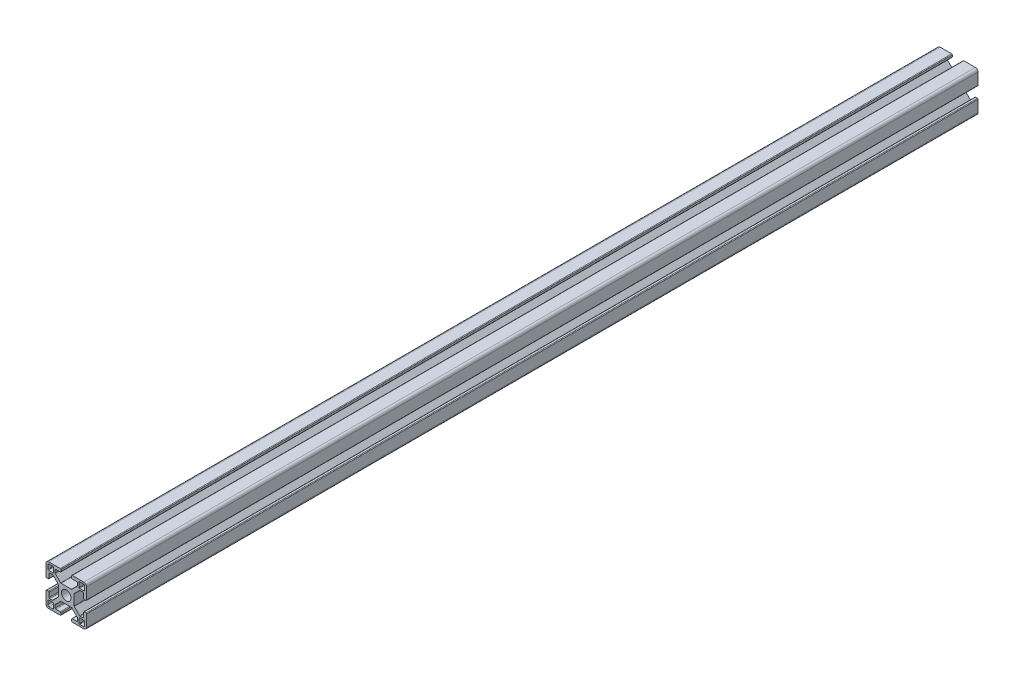
from build123d import *

# Parameters (mm, degrees)
SKETCH1_R           = 3.52998588
BOSS_EXTRUDE1_DEPTH = 330.2


with BuildPart() as part:
    # Sketch1 → Boss-Extrude1 (new, symmetric)
    with BuildSketch(Plane.XY):
        with BuildLine():
            Line((14.49994, -4), (13.24247465, -4))
            ThreePointArc((13.24247465, -4), (12.88892126, -4.146446609), (12.74247465, -4.5))
            Line((12.74247465, -4.5), (12.74247465, -7.732519321))
            ThreePointArc((12.74247465, -7.732519321), (12.602449697, -8.097296796), (12.242781236, -8.249967))
            Line((12.242781236, -8.249967), (10.260188032, -8.249967))
            ThreePointArc((10.260188032, -8.249967), (10.068847082, -8.211906919), (9.906636056, -8.103520976))
            Line((9.906636056, -8.103520976), (5.981117769, -4.178002689))
            ThreePointArc((5.981117769, -4.178002689), (5.872731827, -4.015791664), (5.834671745, -3.824450713))
            Line((5.834671745, -3.824450713), (5.834671745, -1.01249595))
            Line((5.834671745, -1.01249595), (5.834671745, 0.88749645))
            Line((5.834671745, 0.88749645), (5.834671745, 3.824450713))
            ThreePointArc((5.834671745, 3.824450713), (5.872731827, 4.015791664), (5.981117769, 4.178002689))
            Line((5.981117769, 4.178002689), (9.906636056, 8.103520976))
            ThreePointArc((9.906636056, 8.103520976), (10.068847082, 8.211906919), (10.260188032, 8.249967))
            Line((10.260188032, 8.249967), (12.242781236, 8.249967))
            ThreePointArc((12.242781236, 8.249967), (12.602449697, 8.097296796), (12.74247465, 7.732519321))
            Line((12.74247465, 7.732519321), (12.74247465, 4.5))
            ThreePointArc((12.74247465, 4.5), (12.88892126, 4.146446609), (13.24247465, 4))
            Line((13.24247465, 4), (14.49994, 4))
            ThreePointArc((14.49994, 4), (14.853493391, 4.146446609), (14.99994, 4.5))
            Line((14.99994, 4.5), (14.99994, 12.999948))
            ThreePointArc((14.99994, 12.999948), (14.414155906, 14.414155906), (12.999948, 14.99994))
            Line((12.999948, 14.99994), (4.5, 14.99994))
            ThreePointArc((4.5, 14.99994), (4.146446609, 14.853493391), (4, 14.49994))
            Line((4, 14.49994), (4, 13.24247465))
            ThreePointArc((4, 13.24247465), (4.146446609, 12.88892126), (4.5, 12.74247465))
            Line((4.5, 12.74247465), (7.732519321, 12.74247465))
            ThreePointArc((7.732519321, 12.74247465), (8.097296796, 12.602449697), (8.249967, 12.242781236))
            Line((8.249967, 12.242781236), (8.249967, 10.260188032))
            ThreePointArc((8.249967, 10.260188032), (8.211906919, 10.068847082), (8.103520976, 9.906636056))
            Line((8.103520976, 9.906636056), (4.178002689, 5.981117769))
            ThreePointArc((4.178002689, 5.981117769), (4.015791664, 5.872731827), (3.824450713, 5.834671745))
            Line((3.824450713, 5.834671745), (0.9499962, 5.834671745))
            Line((0.9499962, 5.834671745), (-0.9499962, 5.834671745))
            Line((-0.9499962, 5.834671745), (-3.824450713, 5.834671745))
            ThreePointArc((-3.824450713, 5.834671745), (-4.015791664, 5.872731827), (-4.178002689, 5.981117769))
            Line((-4.178002689, 5.981117769), (-8.103520976, 9.906636056))
            ThreePointArc((-8.103520976, 9.906636056), (-8.211906919, 10.068847082), (-8.249967, 10.260188032))
            Line((-8.249967, 10.260188032), (-8.249967, 12.242781236))
            ThreePointArc((-8.249967, 12.242781236), (-8.097296796, 12.602449697), (-7.732519321, 12.74247465))
            Line((-7.732519321, 12.74247465), (-4.5, 12.74247465))
            ThreePointArc((-4.5, 12.74247465), (-4.146446609, 12.88892126), (-4, 13.24247465))
            Line((-4, 13.24247465), (-4, 14.49994))
            ThreePointArc((-4, 14.49994), (-4.146446609, 14.853493391), (-4.5, 14.99994))
            Line((-4.5, 14.99994), (-12.999948, 14.99994))
            ThreePointArc((-12.999948, 14.99994), (-14.414155906, 14.414155906), (-14.99994, 12.999948))
            Line((-14.99994, 12.999948), (-14.99994, 4.5))
            ThreePointArc((-14.99994, 4.5), (-14.853493391, 4.146446609), (-14.49994, 4))
            Line((-14.49994, 4), (-13.24247465, 4))
            ThreePointArc((-13.24247465, 4), (-12.88892126, 4.146446609), (-12.74247465, 4.5))
            Line((-12.74247465, 4.5), (-12.74247465, 7.732519321))
            ThreePointArc((-12.74247465, 7.732519321), (-12.602449697, 8.097296796), (-12.242781236, 8.249967))
            Line((-12.242781236, 8.249967), (-10.260188032, 8.249967))
            ThreePointArc((-10.260188032, 8.249967), (-10.068847082, 8.211906919), (-9.906636056, 8.103520976))
            Line((-9.906636056, 8.103520976), (-5.981117769, 4.178002689))
            ThreePointArc((-5.981117769, 4.178002689), (-5.872731827, 4.015791664), (-5.834671745, 3.824450713))
            Line((-5.834671745, 3.824450713), (-5.834671745, 0.88749645))
            Line((-5.834671745, 0.88749645), (-5.834671745, -1.01249595))
            Line((-5.834671745, -1.01249595), (-5.834671745, -3.824450713))
            ThreePointArc((-5.834671745, -3.824450713), (-5.872731827, -4.015791664), (-5.981117769, -4.178002689))
            Line((-5.981117769, -4.178002689), (-9.906636056, -8.103520976))
            ThreePointArc((-9.906636056, -8.103520976), (-10.068847082, -8.211906919), (-10.260188032, -8.249967))
            Line((-10.260188032, -8.249967), (-12.242781236, -8.249967))
            ThreePointArc((-12.242781236, -8.249967), (-12.602449697, -8.097296796), (-12.74247465, -7.732519321))
            Line((-12.74247465, -7.732519321), (-12.74247465, -4.5))
            ThreePointArc((-12.74247465, -4.5), (-12.88892126, -4.146446609), (-13.24247465, -4))
            Line((-13.24247465, -4), (-14.49994, -4))
            ThreePointArc((-14.49994, -4), (-14.853493391, -4.146446609), (-14.99994, -4.5))
            Line((-14.99994, -4.5), (-14.99994, -12.999948))
            ThreePointArc((-14.99994, -12.999948), (-14.414155906, -14.414155906), (-12.999948, -14.99994))
            Line((-12.999948, -14.99994), (-4.5, -14.99994))
            ThreePointArc((-4.5, -14.99994), (-4.146446609, -14.853493391), (-4, -14.49994))
            Line((-4, -14.49994), (-4, -13.24247465))
            ThreePointArc((-4, -13.24247465), (-4.146446609, -12.88892126), (-4.5, -12.74247465))
            Line((-4.5, -12.74247465), (-7.732519321, -12.74247465))
            ThreePointArc((-7.732519321, -12.74247465), (-8.097296796, -12.602449697), (-8.249967, -12.242781236))
            Line((-8.249967, -12.242781236), (-8.249967, -10.260188032))
            ThreePointArc((-8.249967, -10.260188032), (-8.211906919, -10.068847082), (-8.103520976, -9.906636056))
            Line((-8.103520976, -9.906636056), (-4.178002689, -5.981117769))
            ThreePointArc((-4.178002689, -5.981117769), (-4.015791664, -5.872731827), (-3.824450713, -5.834671745))
            Line((-3.824450713, -5.834671745), (-0.9499962, -5.834671745))
            Line((-0.9499962, -5.834671745), (0.9499962, -5.834671745))
            Line((0.9499962, -5.834671745), (3.824450713, -5.834671745))
            ThreePointArc((3.824450713, -5.834671745), (4.015791664, -5.872731827), (4.178002689, -5.981117769))
            Line((4.178002689, -5.981117769), (8.103520976, -9.906636056))
            ThreePointArc((8.103520976, -9.906636056), (8.211906919, -10.068847082), (8.249967, -10.260188032))
            Line((8.249967, -10.260188032), (8.249967, -12.242781236))
            ThreePointArc((8.249967, -12.242781236), (8.097296796, -12.602449697), (7.732519321, -12.74247465))
            Line((7.732519321, -12.74247465), (4.5, -12.74247465))
            ThreePointArc((4.5, -12.74247465), (4.146446609, -12.88892126), (4, -13.24247465))
            Line((4, -13.24247465), (4, -14.49994))
            ThreePointArc((4, -14.49994), (4.146446609, -14.853493391), (4.5, -14.99994))
            Line((4.5, -14.99994), (12.999948, -14.99994))
            ThreePointArc((12.999948, -14.99994), (14.414155906, -14.414155906), (14.99994, -12.999948))
            Line((14.99994, -12.999948), (14.99994, -4.5))
            ThreePointArc((14.99994, -4.5), (14.853493391, -4.146446609), (14.49994, -4))
        make_face()
        Circle(SKETCH1_R, mode=Mode.SUBTRACT)
        with BuildLine():
            Line((-12.6999492, -13.6999452), (-9.880960476, -13.6999452))
            ThreePointArc((-9.880960476, -13.6999452), (-9.61155387, -13.58835333), (-9.499962, -13.318946724))
            Line((-9.499962, -13.318946724), (-9.499962, -9.87996048))
            ThreePointArc((-9.499962, -9.87996048), (-9.611260978, -9.611260978), (-9.87996048, -9.499962))
            Line((-9.87996048, -9.499962), (-13.318946724, -9.499962))
            ThreePointArc((-13.318946724, -9.499962), (-13.58835333, -9.61155387), (-13.6999452, -9.880960476))
            Line((-13.6999452, -9.880960476), (-13.6999452, -12.6999492))
            ThreePointArc((-13.6999452, -12.6999492), (-13.407053153, -13.407053153), (-12.6999492, -13.6999452))
        make_face(mode=Mode.SUBTRACT)
        with BuildLine():
            Line((13.6999452, -12.6999492), (13.6999452, -9.880960476))
            ThreePointArc((13.6999452, -9.880960476), (13.58835333, -9.61155387), (13.318946724, -9.499962))
            Line((13.318946724, -9.499962), (9.87996048, -9.499962))
            ThreePointArc((9.87996048, -9.499962), (9.611260978, -9.611260978), (9.499962, -9.87996048))
            Line((9.499962, -9.87996048), (9.499962, -13.318946724))
            ThreePointArc((9.499962, -13.318946724), (9.61155387, -13.58835333), (9.880960476, -13.6999452))
            Line((9.880960476, -13.6999452), (12.6999492, -13.6999452))
            ThreePointArc((12.6999492, -13.6999452), (13.407053153, -13.407053153), (13.6999452, -12.6999492))
        make_face(mode=Mode.SUBTRACT)
        with BuildLine():
            Line((9.87996048, 9.499962), (13.318946724, 9.499962))
            ThreePointArc((13.318946724, 9.499962), (13.58835333, 9.61155387), (13.6999452, 9.880960476))
            Line((13.6999452, 9.880960476), (13.6999452, 12.6999492))
            ThreePointArc((13.6999452, 12.6999492), (13.407053153, 13.407053153), (12.6999492, 13.6999452))
            Line((12.6999492, 13.6999452), (9.880960476, 13.6999452))
            ThreePointArc((9.880960476, 13.6999452), (9.61155387, 13.58835333), (9.499962, 13.318946724))
            Line((9.499962, 13.318946724), (9.499962, 9.87996048))
            ThreePointArc((9.499962, 9.87996048), (9.611260978, 9.611260978), (9.87996048, 9.499962))
        make_face(mode=Mode.SUBTRACT)
        with BuildLine():
            Line((-13.6999452, 12.6999492), (-13.6999452, 9.880960476))
            ThreePointArc((-13.6999452, 9.880960476), (-13.58835333, 9.61155387), (-13.318946724, 9.499962))
            Line((-13.318946724, 9.499962), (-9.87996048, 9.499962))
            ThreePointArc((-9.87996048, 9.499962), (-9.611260978, 9.611260978), (-9.499962, 9.87996048))
            Line((-9.499962, 9.87996048), (-9.499962, 13.318946724))
            ThreePointArc((-9.499962, 13.318946724), (-9.61155387, 13.58835333), (-9.880960476, 13.6999452))
            Line((-9.880960476, 13.6999452), (-12.6999492, 13.6999452))
            ThreePointArc((-12.6999492, 13.6999452), (-13.407053153, 13.407053153), (-13.6999452, 12.6999492))
        make_face(mode=Mode.SUBTRACT)
    extrude(amount=BOSS_EXTRUDE1_DEPTH, both=True)


solid = part.part
